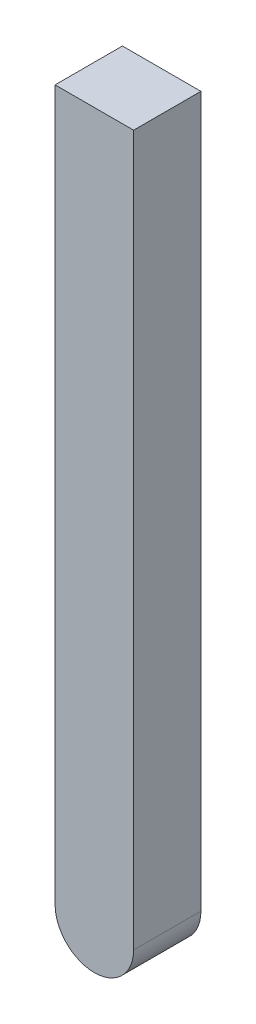
from build123d import *

# Parameters (mm, degrees)
RESSALTO_EXTRUS_O1_DEPTH = 0.3


with BuildPart() as part:
    # Esboço1 → Ressalto-extrusão1 (new, symmetric)
    with BuildSketch(Plane.XY):
        with BuildLine():
            Line((-0.35, 3.165), (-0.35, -3.165))
            ThreePointArc((-0.35, -3.165), (0, -3.515), (0.35, -3.165))
            Line((0.35, -3.165), (0.35, 3.165))
            Line((0.35, 3.165), (-0.35, 3.165))
        make_face()
    extrude(amount=RESSALTO_EXTRUS_O1_DEPTH, both=True)


solid = part.part
